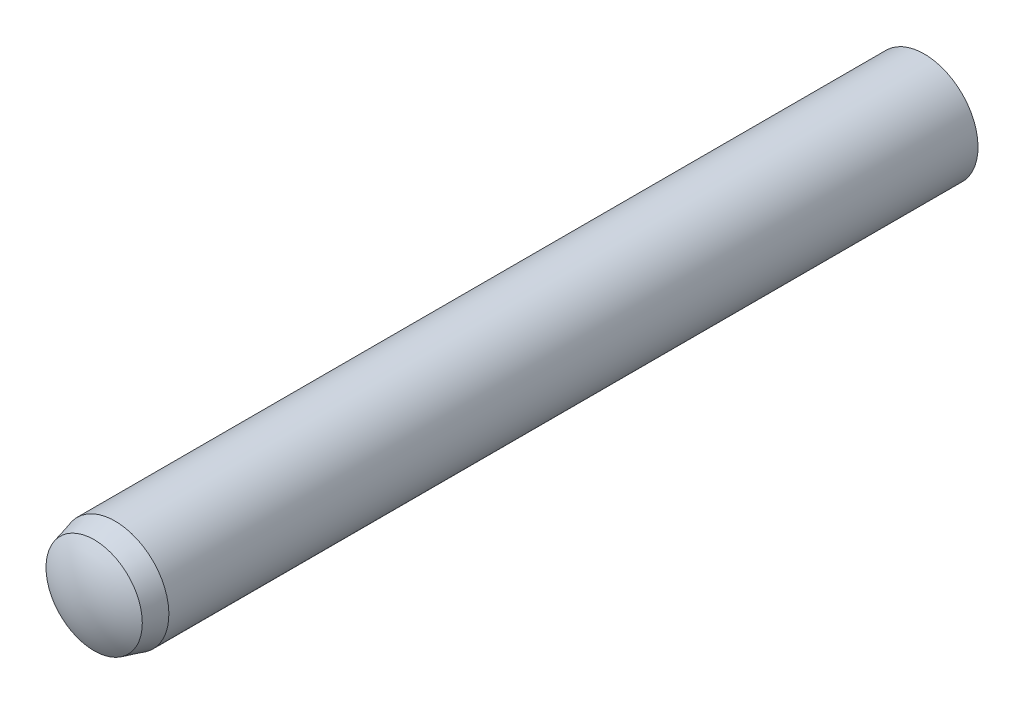
from build123d import *


with BuildPart() as part:
    # Sketch3 → Revolve1 (revolve)
    with BuildSketch(Plane(origin=(0, 0, 0), x_dir=(0, 0, -1), z_dir=(1, 0, 0)), mode=Mode.PRIVATE) as revolve1_sk:
        with BuildLine():
            Line((-10, 0), (10, 0))
            ThreePointArc((10, 0), (9.904230523, 0.652519157), (9.625, 1.25))
            Line((9.625, 1.25), (-9.1875, 1.25))
            Line((-9.1875, 1.25), (-9.675, 1.119374769))
            ThreePointArc((-9.675, 1.119374769), (-9.917106283, 0.582800324), (-10, 0))
        make_face()
    revolve(revolve1_sk.sketch.rotate(Axis((0, 0, 10), (0, 0, -1)), 180), axis=Axis((0, 0, 10), (0, 0, -1)))


solid = part.part
